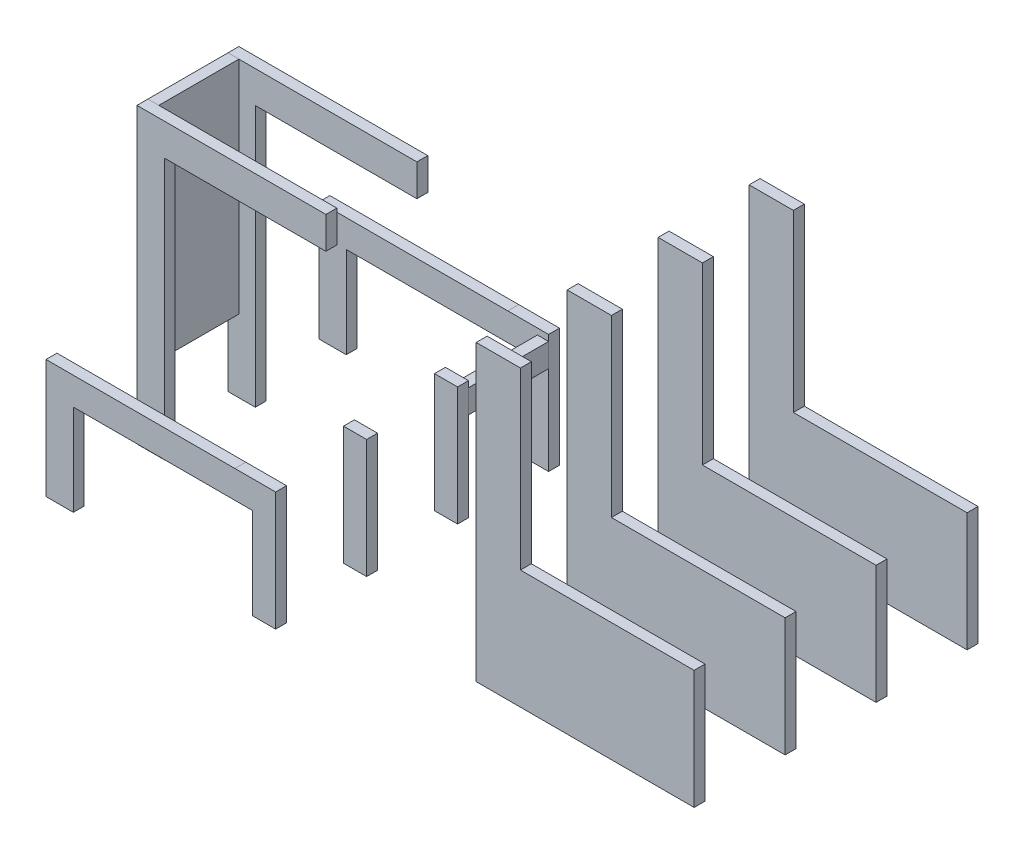
from build123d import *

# Parameters (mm, degrees)
BOSS_EXTRUDE1_DEPTH     = 12
BOSS_EXTRUDE1_2_DEPTH   = 12
LPATTERN1_COUNT         = 4
LPATTERN1_PITCH         = 100
CUT_EXTRUDE1_DEPTH      = 616.077080733
CUT_EXTRUDE1_DEPTH_BACK = 616.077080733
SKETCH3_W               = 196.970786409
SKETCH3_H               = 100.21171673
SKETCH4_W               = 88
SKETCH4_H               = 242.685081652
BOSS_EXTRUDE2_DEPTH     = 12
SKETCH5_W               = 12.264074193
SKETCH5_H               = 25.861875792
BOSS_EXTRUDE3_DEPTH     = 88
SKETCH6_W               = 207.630199012
SKETCH6_H               = 191.858187539
CUT_EXTRUDE2_DEPTH      = 661.048343111
SKETCH7_W               = 196.970786409
SKETCH7_H               = 30.334481492
CUT_EXTRUDE3_DEPTH      = 184


with BuildPart() as part:
    # Sketch2 → Boss-Extrude1 (new body)
    with BuildSketch(Plane.XY):
        Polygon((-466.695758925, -172.088134213), (-466.695758925, -15.359769698), (-289.091328682, -15.359769698), (-289.091328682, 19.748082792), (-496.721527694, 19.748082792), (-496.721527694, -302.634332435), (-244.332211131, -302.634332435), (-244.332211131, -172.088134213), align=None)
    extrude(amount=BOSS_EXTRUDE1_DEPTH)


with BuildPart() as body_2:
    # Sketch2 → Boss-Extrude1 2 (new body)
    with BuildSketch(Plane.XY):
        Polygon((24.729792626, -111.853973807), (215.643385716, -111.853973807), (215.643385716, -242.40017203), (-23.92672943, -242.40017203), (-23.92672943, 80.487514905), (24.729792626, 80.487514905), align=None)
    extrude(amount=BOSS_EXTRUDE1_2_DEPTH)


with BuildPart() as lpattern1_1:
    # LPattern1: pattern copy
    add(body_2.part.moved(Location(Vector(0, 0, 1) * (1 * LPATTERN1_PITCH))))


with BuildPart() as lpattern1_2:
    # LPattern1: pattern copy
    add(body_2.part.moved(Location(Vector(0, 0, 1) * (2 * LPATTERN1_PITCH))))


with BuildPart() as lpattern1_3:
    # LPattern1: pattern copy
    add(body_2.part.moved(Location(Vector(0, 0, 1) * (3 * LPATTERN1_PITCH))))


with BuildPart() as lpattern1_4:
    # LPattern1: pattern copy
    add(part.part.moved(Location(Vector(0, 0, 1) * (1 * LPATTERN1_PITCH))))


with BuildPart() as lpattern1_5:
    # LPattern1: pattern copy
    add(part.part.moved(Location(Vector(0, 0, 1) * (2 * LPATTERN1_PITCH))))


with BuildPart() as lpattern1_6:
    # LPattern1: pattern copy
    add(part.part.moved(Location(Vector(0, 0, 1) * (3 * LPATTERN1_PITCH))))


with BuildPart() as cut_extrude1_tool:
    # Sketch3 → Cut-Extrude1 (new, two sides: drawn at the far end of the back side and taken through both)
    with BuildSketch(Plane.XY.offset(112).offset(-CUT_EXTRUDE1_DEPTH_BACK)):
        with Locations((-368.210365721, -252.52847407)):
            Rectangle(SKETCH3_W, SKETCH3_H)
    extrude(amount=CUT_EXTRUDE1_DEPTH + CUT_EXTRUDE1_DEPTH_BACK)


with BuildPart() as part_1:
    add(part.part)

    # Cut-Extrude1: cut by cut_extrude1_tool
    add(cut_extrude1_tool.part, mode=Mode.SUBTRACT)


with BuildPart() as lpattern1_4_1:
    add(lpattern1_4.part)

    # Cut-Extrude1: cut by cut_extrude1_tool
    add(cut_extrude1_tool.part, mode=Mode.SUBTRACT)


with BuildPart() as lpattern1_5_1:
    add(lpattern1_5.part)

    # Cut-Extrude1: cut by cut_extrude1_tool
    add(cut_extrude1_tool.part, mode=Mode.SUBTRACT)


with BuildPart() as lpattern1_6_1:
    add(lpattern1_6.part)

    # Cut-Extrude1: cut by cut_extrude1_tool
    add(cut_extrude1_tool.part, mode=Mode.SUBTRACT)


with BuildPart() as body_9:
    # Sketch4 → Boss-Extrude2 (new body)
    with BuildSketch(Plane.ZY.offset(496.721527694)):
        with Locations((156, -101.594458034)):
            Rectangle(SKETCH4_W, SKETCH4_H)
    extrude(amount=-BOSS_EXTRUDE2_DEPTH)


with BuildPart() as body_10:
    # Sketch5 → Boss-Extrude3 (new body)
    with BuildSketch(Plane.XY.offset(12)):
        with Locations((-250.464248228, -191.737880728)):
            Rectangle(SKETCH5_W, SKETCH5_H)
    extrude(amount=BOSS_EXTRUDE3_DEPTH)


with BuildPart() as cut_extrude2_tool:
    # Sketch6 → Cut-Extrude2 (new, through all)
    with BuildSketch(Plane.XY.offset(312)):
        with Locations((-392.906428188, -76.181010978)):
            Rectangle(SKETCH6_W, SKETCH6_H)
    extrude(amount=-CUT_EXTRUDE2_DEPTH)


with BuildPart() as part_2:
    add(part_1.part)

    # Cut-Extrude2: cut by cut_extrude2_tool
    add(cut_extrude2_tool.part, mode=Mode.SUBTRACT)


with BuildPart() as lpattern1_6_2:
    add(lpattern1_6_1.part)

    # Cut-Extrude2: cut by cut_extrude2_tool
    add(cut_extrude2_tool.part, mode=Mode.SUBTRACT)


with BuildPart() as cut_extrude3_tool:
    # Sketch7 → Cut-Extrude3 (new body)
    with BuildSketch(Plane.XY.offset(212)):
        with Locations((-368.210365721, -187.255374959)):
            Rectangle(SKETCH7_W, SKETCH7_H)
    extrude(amount=-CUT_EXTRUDE3_DEPTH)


with BuildPart() as lpattern1_4_2:
    add(lpattern1_4_1.part)

    # Cut-Extrude3: cut by cut_extrude3_tool
    add(cut_extrude3_tool.part, mode=Mode.SUBTRACT)


with BuildPart() as lpattern1_5_2:
    add(lpattern1_5_1.part)

    # Cut-Extrude3: cut by cut_extrude3_tool
    add(cut_extrude3_tool.part, mode=Mode.SUBTRACT)


with BuildPart() as cut_extrude3_piece_1:
    # of the separate pieces the step leaves, piece 1, a body of its own (cut_extrude3_pieces)
    add(lpattern1_4_2.part.solids().sort_by_distance((-466.695758925, -15.359769698, 100))[0])


with BuildPart() as cut_extrude3_piece_2:
    # of the separate pieces the step leaves, piece 2, a body of its own (cut_extrude3_pieces)
    add(lpattern1_4_2.part.solids().sort_by_distance((-244.332211131, -172.088134213, 100))[0])


with BuildPart() as cut_extrude3_piece_1_of_lpattern1_5:
    # of the separate pieces the step leaves, piece 1, a body of its own (cut_extrude3_pieces_of_lpattern1_5)
    add(lpattern1_5_2.part.solids().sort_by_distance((-466.695758925, -15.359769698, 200))[0])


with BuildPart() as cut_extrude3_piece_2_of_lpattern1_5:
    # of the separate pieces the step leaves, piece 2, a body of its own (cut_extrude3_pieces_of_lpattern1_5)
    add(lpattern1_5_2.part.solids().sort_by_distance((-244.332211131, -172.088134213, 200))[0])


solid = Compound([body_2.part, lpattern1_1.part, lpattern1_2.part, lpattern1_3.part, body_9.part, body_10.part, part_2.part, lpattern1_6_2.part, cut_extrude3_piece_1.part, cut_extrude3_piece_2.part, cut_extrude3_piece_1_of_lpattern1_5.part, cut_extrude3_piece_2_of_lpattern1_5.part])
